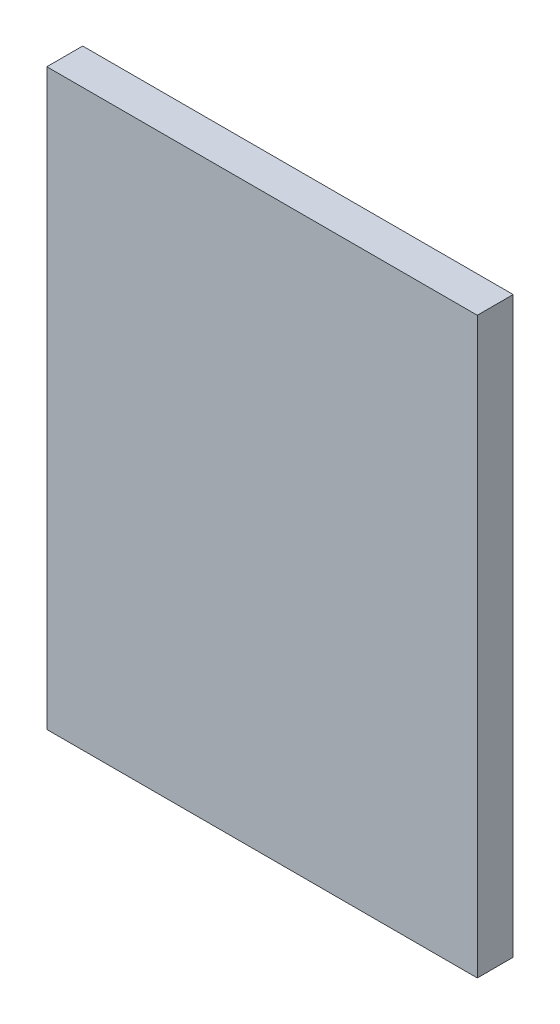
from build123d import *

# Parameters (mm, degrees)
SKETCH1_W           = 1828.8
SKETCH1_H           = 2438.4
BOSS_EXTRUDE1_DEPTH = 152.4


with BuildPart() as part:
    # Sketch1 → Boss-Extrude1 (new body)
    with BuildSketch(Plane.XY):
        Rectangle(SKETCH1_W, SKETCH1_H)
    extrude(amount=BOSS_EXTRUDE1_DEPTH)


solid = part.part
